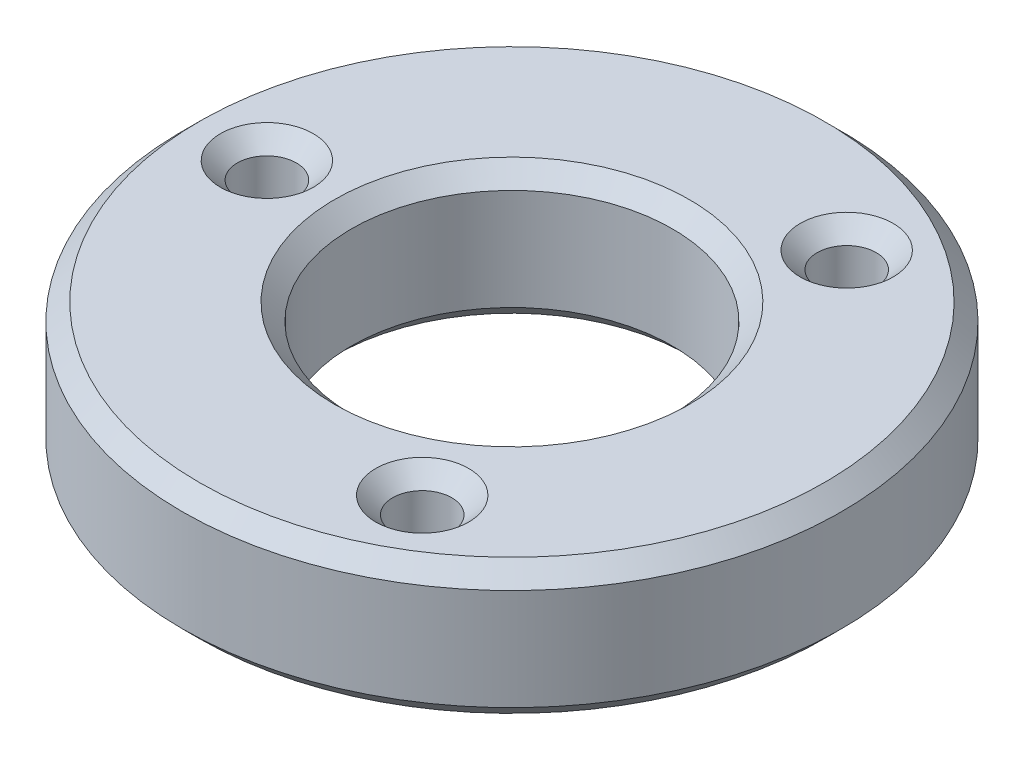
from build123d import *

# Parameters (mm, degrees)
SKETCH1_R           = 19.5
SKETCH1_R_2         = 9.5
SKETCH1_R_3         = 1.75
BOSS_EXTRUDE1_DEPTH = 8
CHAMFER1_SIZE       = 1


with BuildPart() as part:
    # Sketch1 → Boss-Extrude1 (new body)
    with BuildSketch(Plane(origin=(0, 0, 0), x_dir=(1, 0, 0), z_dir=(0, 1, 0))):
        with Locations(Location((0, 0, 0), (0, 0, 270))):
            Circle(SKETCH1_R)
        with Locations(Location((0, 0, 0), (0, 0, 270))):
            Circle(SKETCH1_R_2, mode=Mode.SUBTRACT)
        with Locations(Location((-14.5, 0, 0), (0, 0, 270))):
            Circle(SKETCH1_R_3, mode=Mode.SUBTRACT)
        with Locations(Location((7.25, 12.557368355, 0), (0, 0, 270))):
            Circle(SKETCH1_R_3, mode=Mode.SUBTRACT)
        with Locations(Location((7.25, -12.557368355, 0), (0, 0, 270))):
            Circle(SKETCH1_R_3, mode=Mode.SUBTRACT)
    extrude(amount=BOSS_EXTRUDE1_DEPTH)

    # Chamfer1
    chamfer1_edges = [part.edges().sort_by_distance(p)[0] for p in [
        (7.25, 0, -14.307368355),
        (7.25, 8, -14.307368355),
        (7.25, 0, 10.807368355),
        (7.25, 8, 10.807368355),
        (0, 0, -19.5),
        (0, 8, -19.5),
        (0, 0, -9.5),
        (0, 8, -9.5),
        (-14.5, 0, -1.75),
        (-14.5, 8, -1.75),
    ]]
    chamfer(chamfer1_edges, length=CHAMFER1_SIZE)


solid = part.part
